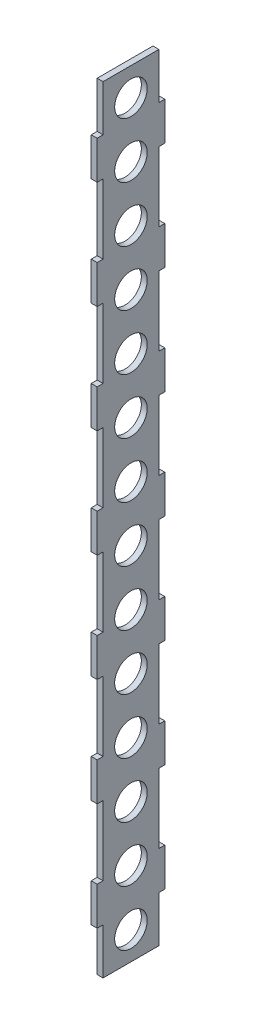
from build123d import *

# Parameters (mm, degrees)
BOSS_EXTRU_1_DEPTH        = 33.175
BOSS_EXTRU_1_DEPTH_BACK   = 3.175
BOSS_EXTRU_1_2_DEPTH      = 33.175
BOSS_EXTRU_1_2_DEPTH_BACK = 3.175
BOSS_EXTRU_1_3_DEPTH      = 33.175
BOSS_EXTRU_1_3_DEPTH_BACK = 3.175
BOSS_EXTRU_1_4_DEPTH      = 33.175
BOSS_EXTRU_1_4_DEPTH_BACK = 3.175
BOSS_EXTRU_1_5_DEPTH      = 33.175
BOSS_EXTRU_1_5_DEPTH_BACK = 3.175
BOSS_EXTRU_1_6_DEPTH      = 33.175
BOSS_EXTRU_1_6_DEPTH_BACK = 3.175
BOSS_EXTRU_1_7_DEPTH      = 33.175
BOSS_EXTRU_1_7_DEPTH_BACK = 3.175
BOSS_EXTRU_2_DEPTH        = 198.346
BOSS_EXTRU_2_DEPTH_BACK   = 218.854
ESQUISSE2_W               = 3.175
ESQUISSE2_H               = 30
CUT_EXTRUDE1_REACH        = 213.245
SKETCH1_R                 = 8.75
LPATTERN1_COUNT           = 14
LPATTERN1_PITCH           = 29.785


with BuildPart() as part:
    # Esquisse1 → Boss.-Extru.1 (new, two sides: drawn at the far end of the back side and taken through both)
    with BuildSketch(Plane.XY.offset(-BOSS_EXTRU_1_DEPTH_BACK)):
        Polygon((-56, 163.6), (-56, 163.346), (-52.825, 163.346), (-52.825, 163.6), (-52.825, 183.6), (-52.825, 183.854), (-56, 183.854), (-56, 183.6), align=None)
    extrude(amount=BOSS_EXTRU_1_DEPTH + BOSS_EXTRU_1_DEPTH_BACK)



with BuildPart() as body_2:
    # Esquisse1 → Boss.-Extru.1 2 (new, two sides: drawn at the far end of the back side and taken through both)
    with BuildSketch(Plane.XY.offset(-BOSS_EXTRU_1_2_DEPTH_BACK)):
        Polygon((-56, 125.733333333), (-56, 125.987333333), (-52.825, 125.987333333), (-52.825, 125.733333333), (-52.825, 105.733333333), (-52.825, 105.479333333), (-56, 105.479333333), (-56, 105.733333333), align=None)
    extrude(amount=BOSS_EXTRU_1_2_DEPTH + BOSS_EXTRU_1_2_DEPTH_BACK)


with BuildPart() as body_3:
    # Esquisse1 → Boss.-Extru.1 3 (new, two sides: drawn at the far end of the back side and taken through both)
    with BuildSketch(Plane.XY.offset(-BOSS_EXTRU_1_3_DEPTH_BACK)):
        Polygon((-56, 67.866666667), (-56, 68.120666667), (-52.825, 68.120666667), (-52.825, 67.866666667), (-52.825, 47.866666667), (-52.825, 47.612666667), (-56, 47.612666667), (-56, 47.866666667), align=None)
    extrude(amount=BOSS_EXTRU_1_3_DEPTH + BOSS_EXTRU_1_3_DEPTH_BACK)


with BuildPart() as body_4:
    # Esquisse1 → Boss.-Extru.1 4 (new, two sides: drawn at the far end of the back side and taken through both)
    with BuildSketch(Plane.XY.offset(-BOSS_EXTRU_1_4_DEPTH_BACK)):
        Polygon((-56, 10), (-56, 10.254), (-52.825, 10.254), (-52.825, 10), (-52.825, -10), (-52.825, -10.254), (-56, -10.254), (-56, -10), align=None)
    extrude(amount=BOSS_EXTRU_1_4_DEPTH + BOSS_EXTRU_1_4_DEPTH_BACK)


with BuildPart() as body_5:
    # Esquisse1 → Boss.-Extru.1 5 (new, two sides: drawn at the far end of the back side and taken through both)
    with BuildSketch(Plane.XY.offset(-BOSS_EXTRU_1_5_DEPTH_BACK)):
        Polygon((-56, -163.6), (-56, -183.6), (-56, -183.854), (-52.825, -183.854), (-52.825, -183.6), (-52.825, -163.6), (-52.825, -163.346), (-56, -163.346), align=None)
    extrude(amount=BOSS_EXTRU_1_5_DEPTH + BOSS_EXTRU_1_5_DEPTH_BACK)


with BuildPart() as body_6:
    # Esquisse1 → Boss.-Extru.1 6 (new, two sides: drawn at the far end of the back side and taken through both)
    with BuildSketch(Plane.XY.offset(-BOSS_EXTRU_1_6_DEPTH_BACK)):
        Polygon((-56, -105.733333333), (-56, -125.733333333), (-56, -125.987333333), (-52.825, -125.987333333), (-52.825, -125.733333333), (-52.825, -105.733333333), (-52.825, -105.479333333), (-56, -105.479333333), align=None)
    extrude(amount=BOSS_EXTRU_1_6_DEPTH + BOSS_EXTRU_1_6_DEPTH_BACK)


with BuildPart() as body_7:
    # Esquisse1 → Boss.-Extru.1 7 (new, two sides: drawn at the far end of the back side and taken through both)
    with BuildSketch(Plane.XY.offset(-BOSS_EXTRU_1_7_DEPTH_BACK)):
        Polygon((-56, -47.866666667), (-56, -67.866666667), (-56, -68.120666667), (-52.825, -68.120666667), (-52.825, -67.866666667), (-52.825, -47.866666667), (-52.825, -47.612666667), (-56, -47.612666667), align=None)
    extrude(amount=BOSS_EXTRU_1_7_DEPTH + BOSS_EXTRU_1_7_DEPTH_BACK)


with BuildPart() as part_1:
    add(part.part)

    add(body_2.part)  # Boss.-Extru.2 merges body 2

    add(body_3.part)  # Boss.-Extru.2 merges body 3

    add(body_4.part)  # Boss.-Extru.2 merges body 4

    add(body_5.part)  # Boss.-Extru.2 merges body 5

    add(body_6.part)  # Boss.-Extru.2 merges body 6

    add(body_7.part)  # Boss.-Extru.2 merges body 7
    # Esquisse2 → Boss.-Extru.2 (add, two sides: drawn at the far end of the back side and taken through both)
    with BuildSketch(Plane.XZ.offset(10.254).offset(-BOSS_EXTRU_2_DEPTH_BACK)):
        with Locations((-54.4125, 15)):
            Rectangle(ESQUISSE2_W, ESQUISSE2_H)
    extrude(amount=BOSS_EXTRU_2_DEPTH + BOSS_EXTRU_2_DEPTH_BACK)

    # Sketch1 → Cut-Extrude1 (cut, up to next)
    with BuildSketch(Plane(origin=(-52.825000001, 0, 0), x_dir=(0, 0, -1), z_dir=(1.0, 8.38677334054915e-12, 0)), mode=Mode.PRIVATE) as cut_extrude1_sk1:
        with Locations(Location((-15, -193.6, 0), (0, 0, 90))):
            Circle(SKETCH1_R)
    cut_extrude1_tool1 = extrude(cut_extrude1_sk1.sketch, amount=-CUT_EXTRUDE1_REACH, mode=Mode.PRIVATE) & part_1.part
    cut_extrude1 = cut_extrude1_tool1.solids().sort_by_distance((-52.825, -193.6, 15))[0]
    add(cut_extrude1, mode=Mode.SUBTRACT)

    # LPattern1: Cut-Extrude1 ×14
    with Locations(*[(0, i * LPATTERN1_PITCH, 0) for i in range(1, LPATTERN1_COUNT)]):
        add(cut_extrude1, mode=Mode.SUBTRACT)


solid = part_1.part
